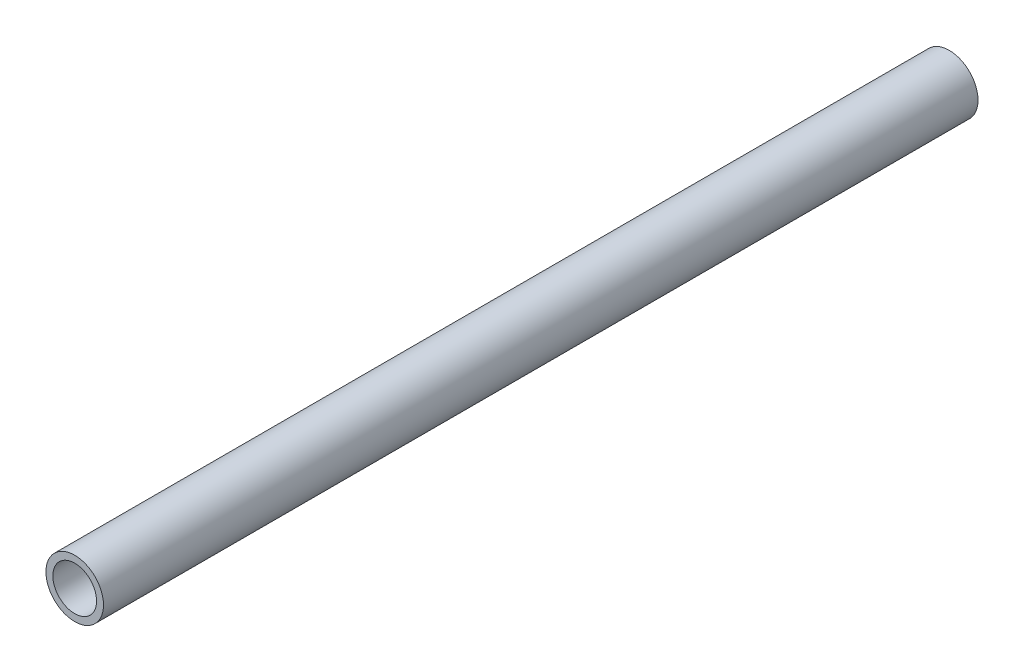
from build123d import *

# Parameters (mm, degrees)
SKETCH1_R           = 12.5
SKETCH1_R_2         = 9.5
EXTRUDE_THIN1_DEPTH = 190


with BuildPart() as part:
    # Sketch1 → Extrude-Thin1 (new, symmetric)
    with BuildSketch(Plane.XY):
        Circle(SKETCH1_R)
        Circle(SKETCH1_R_2, mode=Mode.SUBTRACT)
    extrude(amount=EXTRUDE_THIN1_DEPTH, both=True)


solid = part.part
